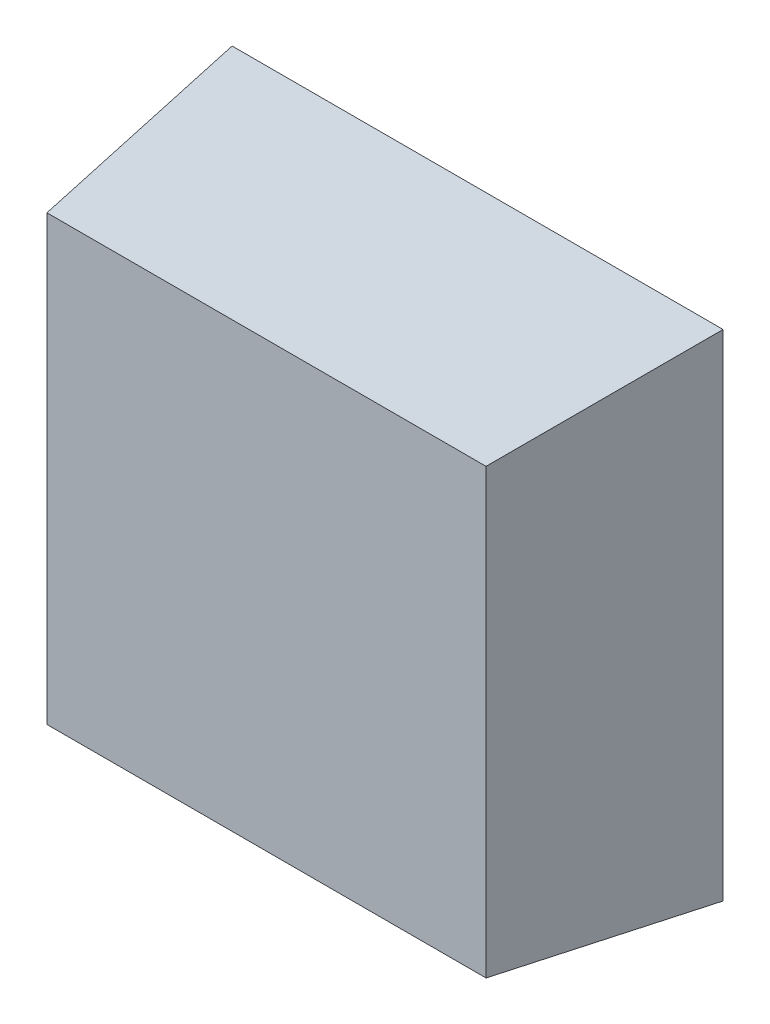
from build123d import *

# Parameters (mm, degrees)
SKETCH1_W           = 73.7
SKETCH1_H           = 74.3
BOSS_EXTRUDE1_DEPTH = 31.69
BOSS_EXTRUDE1_TAPER = 7
SKETCH2_R           = 1.5
BOSS_EXTRUDE2_DEPTH = 10
SKETCH3_R           = 1.5
BOSS_EXTRUDE3_DEPTH = 10
SKETCH4_R           = 1.5
BOSS_EXTRUDE4_DEPTH = 10
SKETCH5_R           = 1.5
BOSS_EXTRUDE5_DEPTH = 10


with BuildPart() as part:
    # Sketch1 → Boss-Extrude1 (new body)
    with BuildSketch(Plane.XY):
        with Locations((-3.742578125, 23.259277344)):
            Rectangle(SKETCH1_W, SKETCH1_H)
    extrude(amount=BOSS_EXTRUDE1_DEPTH, taper=BOSS_EXTRUDE1_TAPER)

    # Sketch2 → Boss-Extrude2 (add)
    with BuildSketch(Plane(origin=(-39.989691599, 0, 4.910116724), x_dir=(0.1218693434051475, 0, 0.992546151641322), z_dir=(-0.992546151641322, 0, 0.1218693434051475))):
        with Locations((-2.003690491, 35.125279491)):
            Circle(SKETCH2_R)
    extrude(amount=BOSS_EXTRUDE2_DEPTH)

    # Sketch3 → Boss-Extrude3 (add)
    with BuildSketch(Plane(origin=(-39.989691599, 0, 4.910116724), x_dir=(0.1218693434051475, 0, 0.992546151641322), z_dir=(-0.992546151641322, 0, 0.1218693434051475))):
        with Locations((-2.079096661, 29.570839743)):
            Circle(SKETCH3_R)
    extrude(amount=BOSS_EXTRUDE3_DEPTH)

    # Sketch4 → Boss-Extrude4 (add)
    with BuildSketch(Plane(origin=(-39.989691599, 0, 4.910116724), x_dir=(0.1218693434051475, 0, 0.992546151641322), z_dir=(-0.992546151641322, 0, 0.1218693434051475))):
        with Locations((-2.088291419, 24.676586011)):
            Circle(SKETCH4_R)
    extrude(amount=BOSS_EXTRUDE4_DEPTH)

    # Sketch5 → Boss-Extrude5 (add)
    with BuildSketch(Plane(origin=(-39.989691599, 0, 4.910116724), x_dir=(0.1218693434051475, 0, 0.992546151641322), z_dir=(-0.992546151641322, 0, 0.1218693434051475))):
        with Locations((-2.246014271, 20.134764101)):
            Circle(SKETCH5_R)
    extrude(amount=BOSS_EXTRUDE5_DEPTH)


solid = part.part
